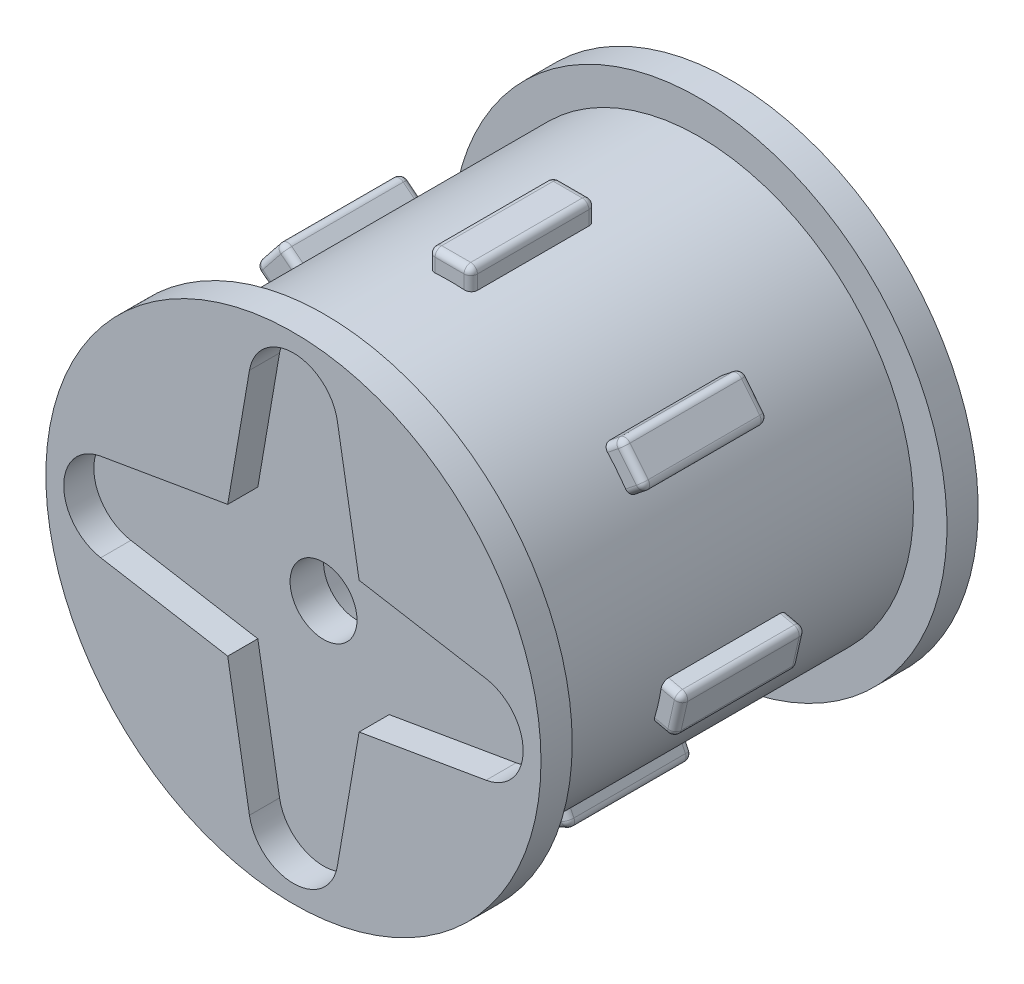
from build123d import *

# Parameters (mm, degrees)
AUFSATZ_LINEAR_AUSTRAGEN1_DEPTH      = 9.8
AUFSATZ_LINEAR_AUSTRAGEN1_DEPTH_BACK = 9.8
SKIZZE1_R                            = 9.6
SKIZZE2_R                            = 11.1
AUFSATZ_LINEAR_AUSTRAGEN2_DEPTH      = 1.4
AUFSATZ_LINEAR_START                 = -1.4
SKIZZE3_R                            = 11.1
AUFSATZ_LINEAR_AUSTRAGEN3_DEPTH      = 1.4
SCHNITT_LINEAR_AUSTRAGEN1_DEPTH      = 1.35
KREISMUSTER1_COUNT                   = 4
SKIZZE9_R                            = 1.5
SCHNITT_LINEAR_AUSTRAGEN2_DEPTH      = 25.072442751
SKIZZE11_W                           = 1.9
SKIZZE11_H                           = 1.78
AUFSATZ_LINEAR_AUSTRAGEN4_DEPTH      = 2.8
KREISMUSTER2_COUNT                   = 7
VERRUNDUNG1_R                        = 0.3


with BuildPart() as part:
    # Skizze1 → Aufsatz-Linear austragen1 (new, two sides: drawn at the far end of the back side and taken through both)
    with BuildSketch(Plane.XY.offset(-AUFSATZ_LINEAR_AUSTRAGEN1_DEPTH_BACK)):
        Circle(SKIZZE1_R)
    extrude(amount=AUFSATZ_LINEAR_AUSTRAGEN1_DEPTH + AUFSATZ_LINEAR_AUSTRAGEN1_DEPTH_BACK)

    # Skizze2 → Aufsatz-Linear austragen2 (add)
    with BuildSketch(Plane.XY.offset(9.8)):
        Circle(SKIZZE2_R)
    extrude(amount=-AUFSATZ_LINEAR_AUSTRAGEN2_DEPTH)

    # Skizze3 → Aufsatz-Linear austragen3 (add)
    with BuildSketch(Plane(origin=(0, 0, -9.8), x_dir=(-1, 0, 0), z_dir=(0, 0, -1)).offset(AUFSATZ_LINEAR_START)):
        Circle(SKIZZE3_R)
    extrude(amount=AUFSATZ_LINEAR_AUSTRAGEN3_DEPTH)

    # Skizze4 → Schnitt-Linear austragen1 (cut)
    with BuildSketch(Plane.XY.offset(9.8)):
        with BuildLine():
            Line((-1.971343548, 8.637349398), (-3.351284031, 0.573493976))
            ThreePointArc((-3.351284031, 0.573493976), (0, -3.4), (3.351284031, 0.573493976))
            Line((3.351284031, 0.573493976), (1.971343548, 8.637349398))
            ThreePointArc((1.971343548, 8.637349398), (0, 10.3), (-1.971343548, 8.637349398))
        make_face()
    schnitt_linear_austragen1 = extrude(amount=-SCHNITT_LINEAR_AUSTRAGEN1_DEPTH, mode=Mode.SUBTRACT)

    # Kreismuster1: Schnitt-Linear austragen1 ×4 about axis
    kreismuster1_axis = Axis((0, 0, -9.8), (0, 0, 1))
    for i in range(1, KREISMUSTER1_COUNT):
        add(schnitt_linear_austragen1.rotate(kreismuster1_axis, i * 360 / KREISMUSTER1_COUNT), mode=Mode.SUBTRACT)

    # Skizze8 → Schnitt-Rotation1 (revolve, cut)
    with BuildSketch(Plane(origin=(0, 0, 0), x_dir=(0, 0, -1), z_dir=(1, 0, 0))):
        Polygon((9.8, 0), (9.8, 8), (8.4, 8), (-6.95, 3.5), (-6.95, 0), align=None)
    revolve(axis=Axis((0, 0, -9.8), (0, 0, 1)), mode=Mode.SUBTRACT)

    # Skizze9 → Schnitt-Linear austragen2 (cut, through all)
    with BuildSketch(Plane.XY.offset(8.45)):
        Circle(SKIZZE9_R)
    extrude(amount=-SCHNITT_LINEAR_AUSTRAGEN2_DEPTH, mode=Mode.SUBTRACT)

    # Skizze11 → Aufsatz-Linear austragen4 (add, symmetric)
    with BuildSketch(Plane(origin=(0, 0, 0), x_dir=(-1, 0, 0), z_dir=(0, 0, -1))):
        with Locations((0, 9.6)):
            Rectangle(SKIZZE11_W, SKIZZE11_H)
    aufsatz_linear_austragen4 = extrude(amount=AUFSATZ_LINEAR_AUSTRAGEN4_DEPTH, both=True)

    # Kreismuster2: Aufsatz-Linear austragen4 ×7 about axis
    kreismuster2_axis = Axis((0, 0, -9.8), (0, 0, 1))
    for i in range(1, KREISMUSTER2_COUNT):
        add(aufsatz_linear_austragen4.rotate(kreismuster2_axis, i * 360 / KREISMUSTER2_COUNT))

    # Verrundung1
    verrundung1_edges = [part.edges().sort_by_distance(p)[0] for p in [
        (8.201412251, 6.540408021, 2.8),
        (7.609096939, 7.28314793, 0),
        (8.201412251, 6.540408021, -2.8),
        (8.793727563, 5.797668113, 0),
        (-8.42739227, 5.505525466, 2.8),
        (-7.242761647, 6.991005282, 2.8),
        (-7.242761647, 6.991005282, -2.8),
        (-8.42739227, 5.505525466, -2.8),
        (-9.558786273, -3.15616161, -2.8),
        (-9.981576048, -1.303798577, -2.8),
        (-9.558786273, -3.15616161, 2.8),
        (-9.981576048, -1.303798577, 2.8),
        (-5.204060098, -8.616815515, -2.8),
        (-3.492219249, -9.44119462, -2.8),
        (-3.492219249, -9.44119462, 2.8),
        (-5.204060098, -8.616815515, 2.8),
        (5.204060098, -8.616815515, 2.8),
        (3.492219249, -9.44119462, 2.8),
        (3.492219249, -9.44119462, -2.8),
        (5.204060098, -8.616815515, -2.8),
        (9.558786273, -3.15616161, 2.8),
        (9.558786273, -3.15616161, -2.8),
        (9.981576048, -1.303798577, 2.8),
        (9.981576048, -1.303798577, -2.8),
        (8.42739227, 5.505525466, 2.8),
        (8.42739227, 5.505525466, -2.8),
        (7.242761647, 6.991005282, -2.8),
        (7.242761647, 6.991005282, 2.8),
        (0.95, 10.021439574, 2.8),
        (0.95, 10.021439574, -2.8),
        (-0.95, 10.021439574, -2.8),
        (-0.95, 10.021439574, 2.8),
        (10.438388686, -1.408063081, 0),
        (10.226993799, -2.334244597, 2.8),
        (10.226993799, -2.334244597, -2.8),
        (10.015598912, -3.260426114, 0),
        (4.551440423, -9.451163424, 2.8),
        (4.551440423, -9.451163424, -2.8),
        (5.407360848, -9.038973872, 0),
        (3.695519999, -9.863352976, 0),
        (-4.551440423, -9.451163424, 2.8),
        (-4.551440423, -9.451163424, -2.8),
        (-5.407360848, -9.038973872, 0),
        (-3.695519999, -9.863352976, 0),
        (-10.226993799, -2.334244597, 2.8),
        (-10.226993799, -2.334244597, -2.8),
        (-10.015598912, -3.260426114, 0),
        (-10.438388686, -1.408063081, 0),
        (-8.201412251, 6.540408021, -2.8),
        (-8.201412251, 6.540408021, 2.8),
        (-8.793727563, 5.797668113, 0),
        (-7.609096939, 7.28314793, 0),
        (0, 10.49, -2.8),
        (0, 10.49, 2.8),
        (0.95, 10.49, 0),
        (-0.95, 10.49, 0),
    ]]
    fillet(verrundung1_edges, radius=VERRUNDUNG1_R)


solid = part.part
